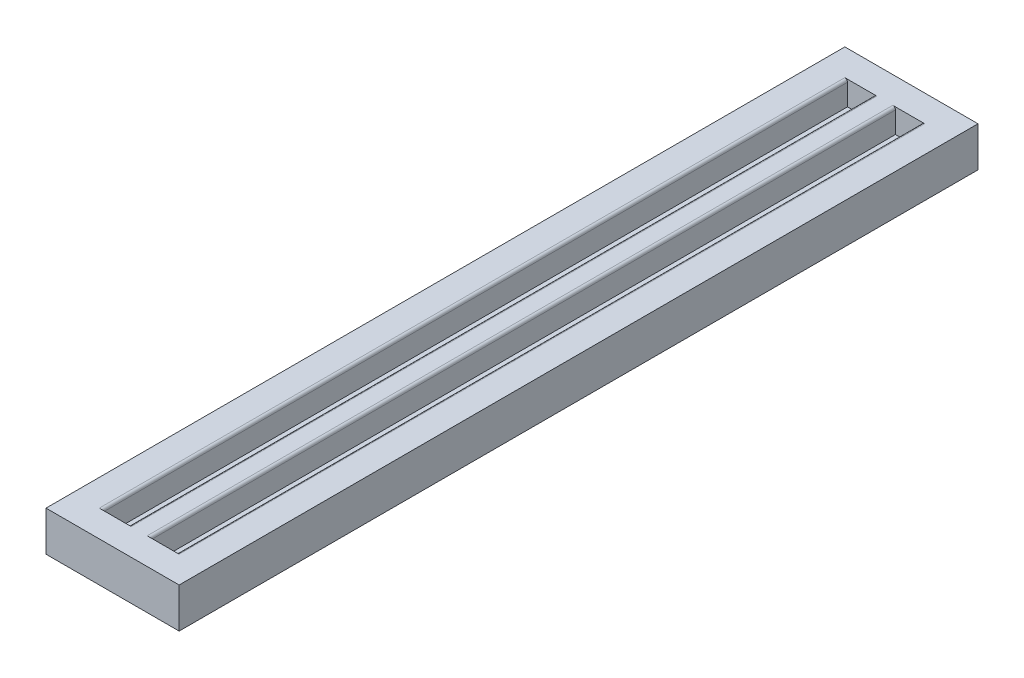
from build123d import *

# Parameters (mm, degrees)
SKETCH1_W           = 250
SKETCH1_H           = 75
BOSS_EXTRUDE1_DEPTH = 750
SKETCH2_W           = 50
SKETCH2_H           = 45
CUT_EXTRUDE1_DEPTH  = 700
FILLET1_R           = 5


with BuildPart() as part:
    # Sketch1 → Boss-Extrude1 (new, symmetric)
    with BuildSketch(Plane.XY):
        Rectangle(SKETCH1_W, SKETCH1_H)
    extrude(amount=BOSS_EXTRUDE1_DEPTH, both=True)

    # Sketch2 → Cut-Extrude1 (cut, symmetric)
    with BuildSketch(Plane.XY):
        with Locations((-45, 15)):
            Rectangle(SKETCH2_W, SKETCH2_H)
        with Locations((45, 15)):
            Rectangle(SKETCH2_W, SKETCH2_H)
    extrude(amount=CUT_EXTRUDE1_DEPTH, both=True, mode=Mode.SUBTRACT)

    # Fillet1
    fillet1_edges = [part.edges().sort_by_distance(p)[0] for p in [
        (-70, 37.5, 0),
        (-20, 37.5, 0),
        (20, 37.5, 0),
        (70, 37.5, 0),
    ]]
    fillet(fillet1_edges, radius=FILLET1_R)


solid = part.part
